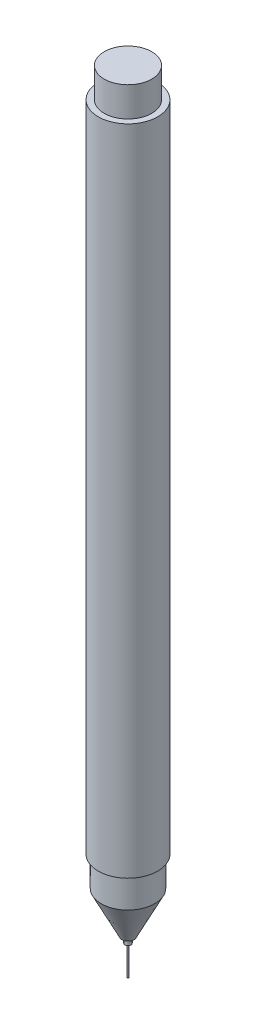
from build123d import *


with BuildPart() as part:
    # Sketch1 → Revolve1 (revolve)
    with BuildSketch(Plane.XY, mode=Mode.PRIVATE) as revolve1_sk:
        Polygon((0, 75), (4, 75), (4, 70), (5, 70), (5, -40), (4.5, -40), (4.5, -45), (1.008981271, -52), (0.508981271, -52), (0.508981271, -53), (0.108981271, -53), (0.108981271, -58), (0, -58), align=None)
    revolve(revolve1_sk.sketch.rotate(Axis((0, 75, 0), (0, -1, 0)), 180), axis=Axis((0, 75, 0), (0, -1, 0)))


solid = part.part
